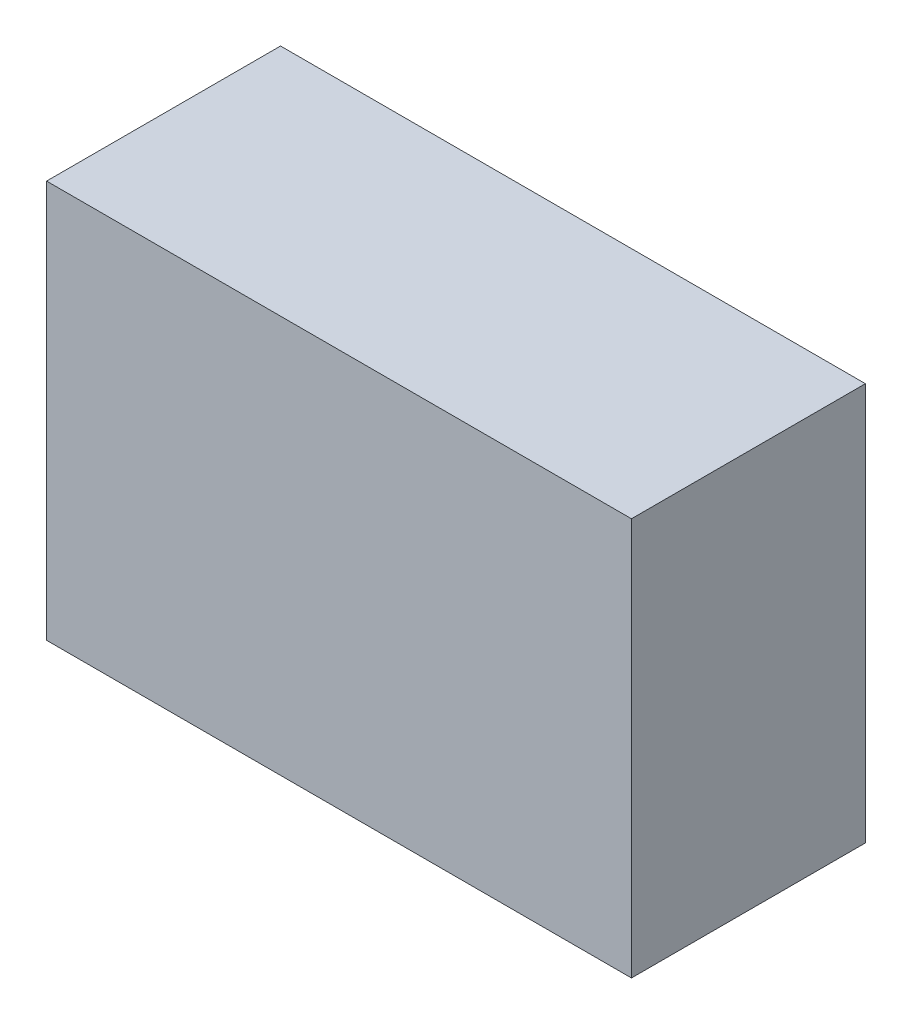
from build123d import *

# Parameters (mm, degrees)
SKETCH_1_W      = 50
SKETCH_1_H      = 34
EXTRUDE_1_DEPTH = 20


with BuildPart() as part:
    # 草图1 → 凸台-拉伸1 (new body)
    with BuildSketch(Plane.XY):
        with Locations((-15.4296875, 10.5390625)):
            Rectangle(SKETCH_1_W, SKETCH_1_H)
    extrude(amount=-EXTRUDE_1_DEPTH)


solid = part.part
